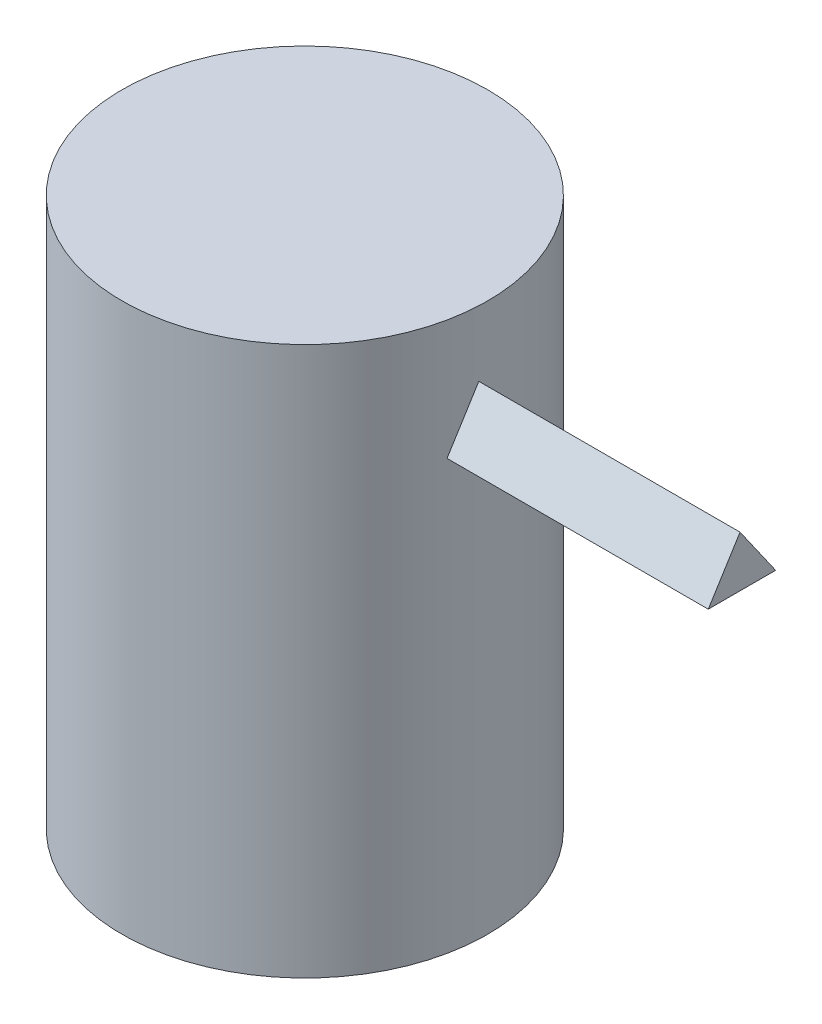
from build123d import *

# Parameters (mm, degrees)
SKETCH1_R           = 7
BOSS_EXTRUDE1_DEPTH = 21
SHELL2_T            = -1
BOSS_EXTRUDE2_DEPTH = 10


with BuildPart() as part:
    # Sketch1 → Boss-Extrude1 (new body)
    with BuildSketch(Plane(origin=(0, 0, 0), x_dir=(1, 0, 0), z_dir=(0, 1, 0))):
        with Locations(Location((0, 0, 0), (0, 0, 90))):
            Circle(SKETCH1_R)
    extrude(amount=BOSS_EXTRUDE1_DEPTH)

    # Shell2
    shell2_openings = [part.faces().sort_by_distance(p)[0] for p in [
        (0, 0, 0),
    ]]
    offset(amount=SHELL2_T, openings=shell2_openings, kind=Kind.INTERSECTION)


with BuildPart() as body_2:
    # Sketch3 → Boss-Extrude2 (new body)
    with BuildSketch(Plane(origin=(7, 0, 0), x_dir=(0, 0, -1), z_dir=(1, 0, 0))):
        Polygon((-0.340580721, 18.503646946), (-1.556940439, 16.557471397), (1.021742163, 16.557471397), align=None)
    extrude(amount=BOSS_EXTRUDE2_DEPTH)


solid = Compound([part.part, body_2.part])
